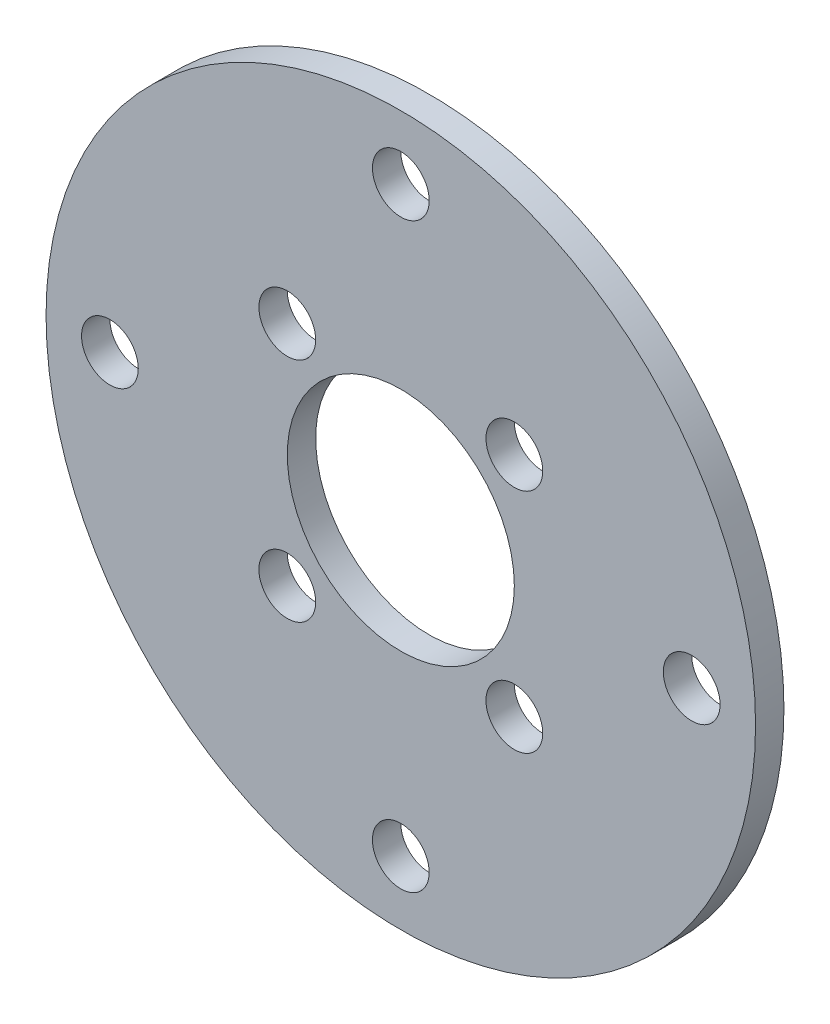
from build123d import *

# Parameters (mm, degrees)
SKETCH1_R           = 25
SKETCH1_R_2         = 8
SKETCH1_R_3         = 2
BOSS_EXTRUDE1_DEPTH = 2


with BuildPart() as part:
    # Sketch1 → Boss-Extrude1 (new body)
    with BuildSketch(Plane.XY):
        Circle(SKETCH1_R)
        Circle(SKETCH1_R_2, mode=Mode.SUBTRACT)
        with Locations((-8, 8)):
            Circle(SKETCH1_R_3, mode=Mode.SUBTRACT)
        with Locations((8, 8)):
            Circle(SKETCH1_R_3, mode=Mode.SUBTRACT)
        with Locations(Location((8, -8, 0), (0, 0, 180))):
            Circle(SKETCH1_R_3, mode=Mode.SUBTRACT)
        with Locations(Location((-8, -8, 0), (0, 0, 180))):
            Circle(SKETCH1_R_3, mode=Mode.SUBTRACT)
        with Locations((0, 20.5)):
            Circle(SKETCH1_R_3, mode=Mode.SUBTRACT)
        with Locations((20.5, 0)):
            Circle(SKETCH1_R_3, mode=Mode.SUBTRACT)
        with Locations((0, -20.5)):
            Circle(SKETCH1_R_3, mode=Mode.SUBTRACT)
        with Locations((-20.5, 0)):
            Circle(SKETCH1_R_3, mode=Mode.SUBTRACT)
    extrude(amount=BOSS_EXTRUDE1_DEPTH)


solid = part.part
